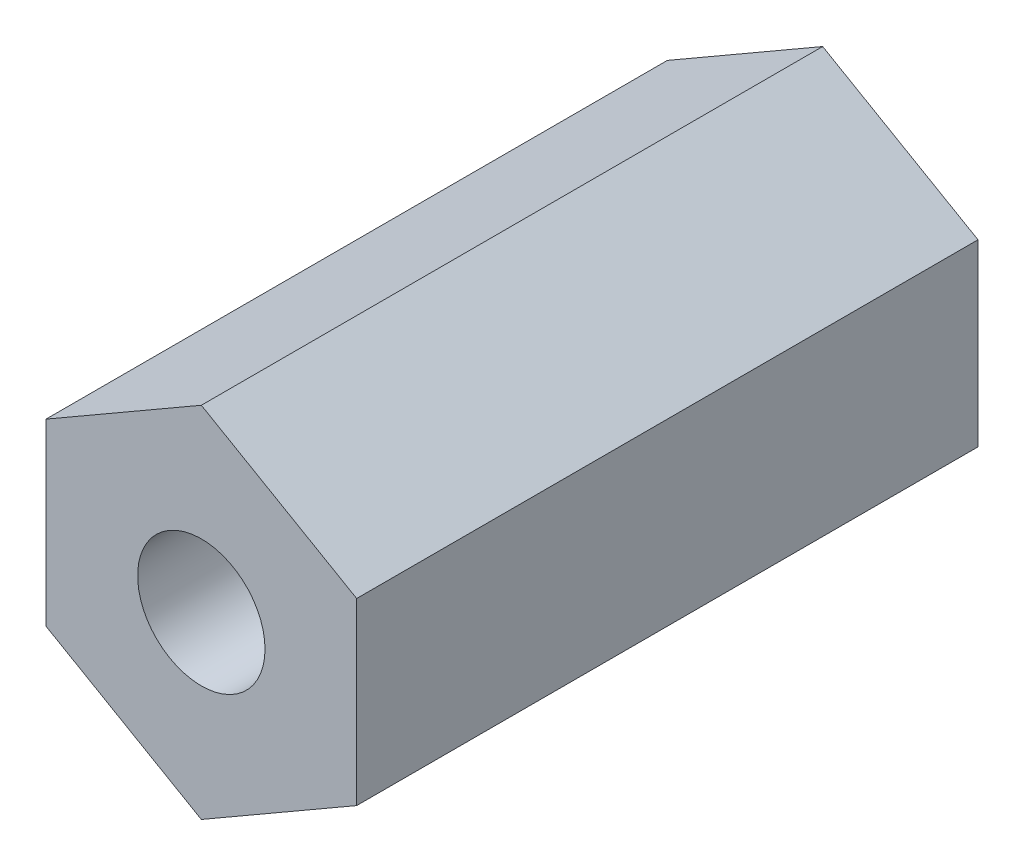
from build123d import *

# Parameters (mm, degrees)
CUERPO_DEPTH        = 10
SK_ROSCA_PASANTE_R  = 1.025
ROSCA_PASANTE_DEPTH = 10


with BuildPart() as part:
    # Sk_Cuerpo → Cuerpo (new body)
    with BuildSketch(Plane.XY):
        Polygon((0, -2.886751346), (2.5, -1.443375673), (2.5, 1.443375673), (0, 2.886751346), (-2.5, 1.443375673), (-2.5, -1.443375673), align=None)
    extrude(amount=CUERPO_DEPTH)

    # Sk_Rosca_pasante → Rosca_pasante (cut)
    with BuildSketch(Plane.XY):
        Circle(SK_ROSCA_PASANTE_R)
    extrude(amount=ROSCA_PASANTE_DEPTH, mode=Mode.SUBTRACT)


solid = part.part
